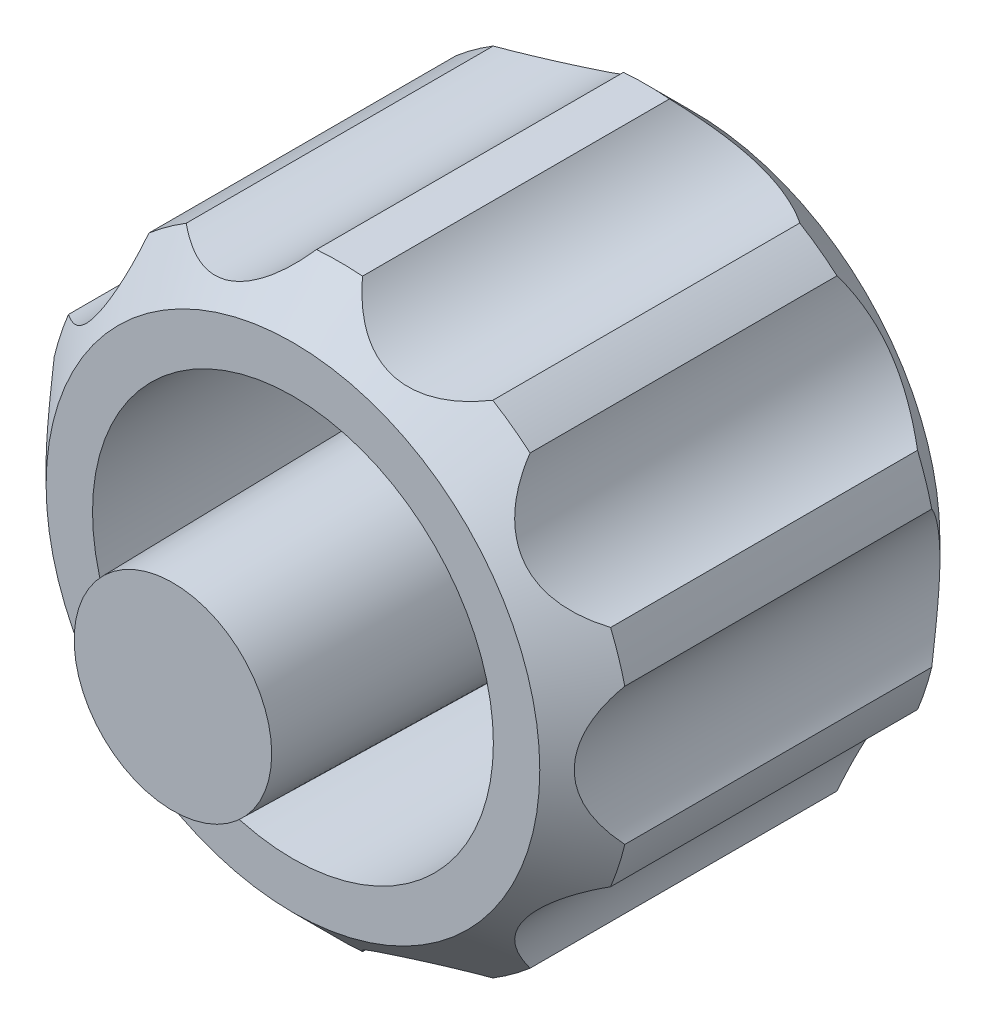
from build123d import *

# Parameters (mm, degrees)
SKETCH20_R          = 3.817056353
BOSS_EXTRUDE1_DEPTH = 3.81
BOSS_EXTRUDE2_START = -1.27
BOSS_EXTRUDE2_DEPTH = 1.27
SKETCH23_R          = 2.032
BOSS_EXTRUDE3_DEPTH = 8.636
BOSS_EXTRUDE3_TAPER = 1
SKETCH24_R          = 1.143
CUT_EXTRUDE1_DEPTH  = 9.144
FILLET1_R           = 1.016


with BuildPart() as part:
    # Sketch20 → Boss-Extrude1 (new, symmetric)
    with BuildSketch(Plane.XY):
        with BuildLine():
            ThreePointArc((-2.91972198, 4.764553238), (-1.554108268, 4.783053432), (-0.438429427, 5.570774061))
            ThreePointArc((-0.438429427, 5.570774061), (0, 5.588), (0.438429427, 5.570774061))
            ThreePointArc((0.438429427, 5.570774061), (1.554108268, 4.783053432), (2.91972198, 4.764553238))
            ThreePointArc((2.91972198, 4.764553238), (3.28454399, 4.520786965), (3.629115694, 4.249148536))
            ThreePointArc((3.629115694, 4.249148536), (4.068708268, 2.956089591), (5.162638828, 2.13843502))
            ThreePointArc((5.162638828, 2.13843502), (5.314503813, 1.726786965), (5.433603115, 1.304492693))
            ThreePointArc((5.433603115, 1.304492693), (5.0292, 0), (5.433603115, -1.304492693))
            ThreePointArc((5.433603115, -1.304492693), (5.314503813, -1.726786965), (5.162638828, -2.13843502))
            ThreePointArc((5.162638828, -2.13843502), (4.068708268, -2.956089591), (3.629115694, -4.249148536))
            ThreePointArc((3.629115694, -4.249148536), (3.28454399, -4.520786965), (2.91972198, -4.764553238))
            ThreePointArc((2.91972198, -4.764553238), (1.554108268, -4.783053432), (0.438429427, -5.570774061))
            ThreePointArc((0.438429427, -5.570774061), (0, -5.588), (-0.438429427, -5.570774061))
            ThreePointArc((-0.438429427, -5.570774061), (-1.554108268, -4.783053432), (-2.91972198, -4.764553238))
            ThreePointArc((-2.91972198, -4.764553238), (-3.28454399, -4.520786965), (-3.629115694, -4.249148536))
            ThreePointArc((-3.629115694, -4.249148536), (-4.068708268, -2.956089591), (-5.162638828, -2.13843502))
            ThreePointArc((-5.162638828, -2.13843502), (-5.314503813, -1.726786965), (-5.433603115, -1.304492693))
            ThreePointArc((-5.433603115, -1.304492693), (-5.0292, 0), (-5.433603115, 1.304492693))
            ThreePointArc((-5.433603115, 1.304492693), (-5.314503813, 1.726786965), (-5.162638828, 2.13843502))
            ThreePointArc((-5.162638828, 2.13843502), (-4.068708268, 2.956089591), (-3.629115694, 4.249148536))
            ThreePointArc((-3.629115694, 4.249148536), (-3.28454399, 4.520786965), (-2.91972198, 4.764553238))
        make_face()
        with Locations(Location((0, 0, 0), (0, 0, 180))):
            Circle(SKETCH20_R, mode=Mode.SUBTRACT)
    extrude(amount=BOSS_EXTRUDE1_DEPTH, both=True)

    # Sketch21 → Boss-Extrude2 (add)
    with BuildSketch(Plane(origin=(0, 0, -3.81), x_dir=(-1, 0, 0), z_dir=(0, 0, -1)).offset(BOSS_EXTRUDE2_START)):
        with BuildLine():
            ThreePointArc((3.629115694, 4.249148536), (3.28454399, 4.520786965), (2.91972198, 4.764553238))
            ThreePointArc((2.91972198, 4.764553238), (1.554108268, 4.783053432), (0.438429427, 5.570774061))
            ThreePointArc((0.438429427, 5.570774061), (0, 5.588), (-0.438429427, 5.570774061))
            ThreePointArc((-0.438429427, 5.570774061), (-1.554108268, 4.783053432), (-2.91972198, 4.764553238))
            ThreePointArc((-2.91972198, 4.764553238), (-3.28454399, 4.520786965), (-3.629115694, 4.249148536))
            ThreePointArc((-3.629115694, 4.249148536), (-4.068708268, 2.956089591), (-5.162638828, 2.13843502))
            ThreePointArc((-5.162638828, 2.13843502), (-5.314503813, 1.726786965), (-5.433603115, 1.304492693))
            ThreePointArc((-5.433603115, 1.304492693), (-5.0292, 0), (-5.433603115, -1.304492693))
            ThreePointArc((-5.433603115, -1.304492693), (-5.314503813, -1.726786965), (-5.162638828, -2.13843502))
            ThreePointArc((-5.162638828, -2.13843502), (-4.068708268, -2.956089591), (-3.629115694, -4.249148536))
            ThreePointArc((-3.629115694, -4.249148536), (-3.28454399, -4.520786965), (-2.91972198, -4.764553238))
            ThreePointArc((-2.91972198, -4.764553238), (-1.554108268, -4.783053432), (-0.438429427, -5.570774061))
            ThreePointArc((-0.438429427, -5.570774061), (0, -5.588), (0.438429427, -5.570774061))
            ThreePointArc((0.438429427, -5.570774061), (1.554108268, -4.783053432), (2.91972198, -4.764553238))
            ThreePointArc((2.91972198, -4.764553238), (3.28454399, -4.520786965), (3.629115694, -4.249148536))
            ThreePointArc((3.629115694, -4.249148536), (4.068708268, -2.956089591), (5.162638828, -2.13843502))
            ThreePointArc((5.162638828, -2.13843502), (5.314503813, -1.726786965), (5.433603115, -1.304492693))
            ThreePointArc((5.433603115, -1.304492693), (5.0292, 0), (5.433603115, 1.304492693))
            ThreePointArc((5.433603115, 1.304492693), (5.314503813, 1.726786965), (5.162638828, 2.13843502))
            ThreePointArc((5.162638828, 2.13843502), (4.068708268, 2.956089591), (3.629115694, 4.249148536))
        make_face()
    extrude(amount=BOSS_EXTRUDE2_DEPTH)

    # Sketch23 → Boss-Extrude3 (add)
    with BuildSketch(Plane.XY.offset(-2.54)):
        Circle(SKETCH23_R)
    extrude(amount=BOSS_EXTRUDE3_DEPTH, taper=BOSS_EXTRUDE3_TAPER)

    # Sketch24 → Cut-Extrude1 (cut)
    with BuildSketch(Plane.XY.offset(-3.81)):
        with Locations(Location((0, 0, 0), (0, 0, 180))):
            Circle(SKETCH24_R)
    extrude(amount=CUT_EXTRUDE1_DEPTH, mode=Mode.SUBTRACT)

    # Sketch25 → Cut-Revolve1 (revolve, cut)
    with BuildSketch(Plane(origin=(0, 0, 0), x_dir=(0, 0, -1), z_dir=(1, 0, 0)), mode=Mode.PRIVATE) as cut_revolve1_sk:
        Polygon((2.923053238, 5.588), (3.81, 4.701053238), (3.81, 5.588), align=None)
        Polygon((-3.81, 5.588), (-2.923053238, 5.588), (-3.81, 4.701053238), align=None)
    revolve(cut_revolve1_sk.sketch.rotate(Axis((0, 0, 0), (0, 0, -1)), 90), axis=Axis((0, 0, 0), (0, 0, -1)), mode=Mode.SUBTRACT)

    # Fillet1
    fillet1_edges = [part.edges().sort_by_distance(p)[0] for p in [
        (1.143, 0, -3.81),
    ]]
    fillet(fillet1_edges, radius=FILLET1_R)


solid = part.part
